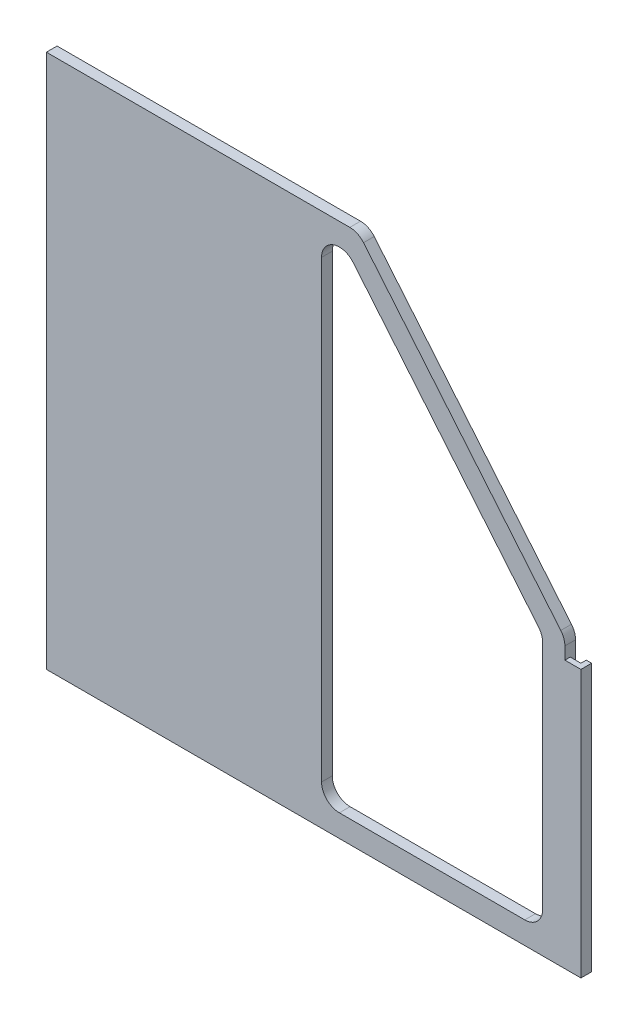
from build123d import *

# Parameters (mm, degrees)
BOSS_EXTRUDE1_DEPTH = 12
SKETCH2_W           = 12
SKETCH2_H           = 300
CUT_EXTRUDE1_DEPTH  = 6


with BuildPart() as part:
    # Sketch1 → Boss-Extrude1 (new body)
    with BuildSketch(Plane.XY):
        with BuildLine():
            Line((45.562175866, 543.226317211), (245.677247379, 302.584656473))
            Line((245.677247379, 302.584656473), (266.942237958, 277.013155986))
            ThreePointArc((266.942237958, 277.013155986), (270.373567716, 271.024119998), (271.564632115, 264.225300867))
            Line((271.564632115, 264.225300867), (271.564632115, 250.438462092))
            Line((271.564632115, 250.438462092), (289.564632115, 250.438462092))
            Line((289.564632115, 250.438462092), (289.564632115, -49.561537908))
            Line((289.564632115, -49.561537908), (-310.435367885, -49.561537908))
            Line((-310.435367885, -49.561537908), (-310.435367885, 550.438462092))
            Line((-310.435367885, 550.438462092), (30.184570023, 550.438462092))
            ThreePointArc((30.184570023, 550.438462092), (38.677004822, 548.545879113), (45.562175866, 543.226317211))
        make_face()
        with BuildLine():
            Line((-1.540507591, -4.561537908), (-1.540507591, 505.438462092))
            ThreePointArc((-1.540507591, 505.438462092), (11.660673278, 524.247397693), (33.837098252, 518.226317211))
            Line((33.837098252, 518.226317211), (241.942237958, 267.976468219))
            ThreePointArc((241.942237958, 267.976468219), (245.373567716, 261.98743223), (246.564632115, 255.1886131))
            Line((246.564632115, 255.1886131), (246.564632115, -4.561537908))
            ThreePointArc((246.564632115, -4.561537908), (240.706767739, -18.703673532), (226.564632115, -24.561537908))
            Line((226.564632115, -24.561537908), (18.459492409, -24.561537908))
            ThreePointArc((18.459492409, -24.561537908), (4.317356785, -18.703673532), (-1.540507591, -4.561537908))
        make_face(mode=Mode.SUBTRACT)
    extrude(amount=-BOSS_EXTRUDE1_DEPTH)

    # Sketch2 → Cut-Extrude1 (cut)
    with BuildSketch(Plane(origin=(0, 0, -12), x_dir=(-1, 0, 0), z_dir=(0, 0, -1))):
        with Locations((-277.564632115, 100.438462092)):
            Rectangle(SKETCH2_W, SKETCH2_H)
    extrude(amount=-CUT_EXTRUDE1_DEPTH, mode=Mode.SUBTRACT)


solid = part.part
